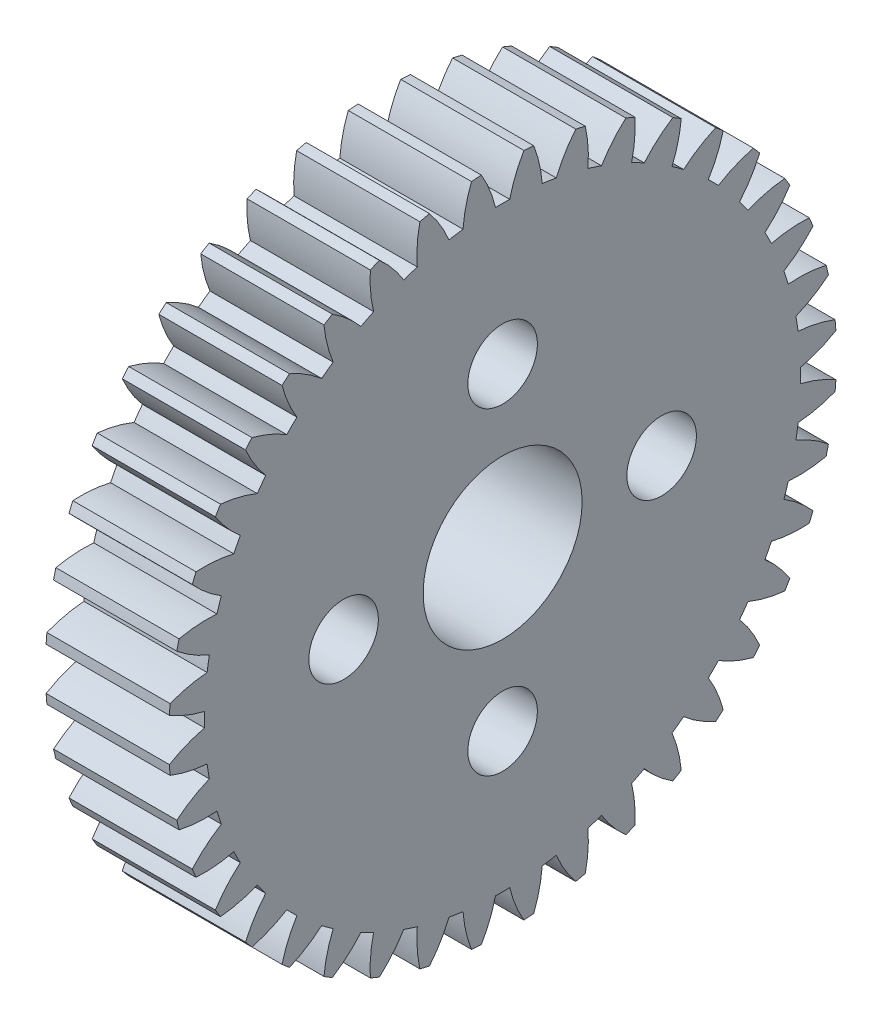
from build123d import *

# Parameters (mm, degrees)
SKETCH1_R           = 4
SKETCH1_R_2         = 1.75
BOSS_EXTRUDE1_DEPTH = 6.2


with BuildPart() as part:
    # Sketch1 → Boss-Extrude1 (new body)
    with BuildSketch(Plane(origin=(0, 0, 0), x_dir=(0, -1, 0), z_dir=(-1, 0, 0))):
        with BuildLine():
            ThreePointArc((-16.276318803, -4.161904158), (-15.328836725, -4.298843929), (-14.371528142, -4.292922065))
            ThreePointArc((-14.371528142, -4.292922065), (-14.264896688, -4.634945899), (-14.150126781, -4.974325389))
            ThreePointArc((-14.150126781, -4.974325389), (-14.928086477, -5.532226367), (-15.614124403, -6.199928961))
            ThreePointArc((-15.614124403, -6.199928961), (-15.521176146, -6.429081664), (-15.424865059, -6.656841436))
            ThreePointArc((-15.424865059, -6.656841436), (-14.467625957, -6.643876399), (-13.523029816, -6.488271387))
            ThreePointArc((-13.523029816, -6.488271387), (-13.364206856, -6.809403506), (-13.197759308, -7.126650702))
            ThreePointArc((-13.197759308, -7.126650702), (-13.878866089, -7.799382702), (-14.452006051, -8.566184746))
            ThreePointArc((-14.452006051, -8.566184746), (-14.324354761, -8.777975887), (-14.193599945, -8.987865186))
            ThreePointArc((-14.193599945, -8.987865186), (-13.250174224, -8.825314583), (-12.341549615, -8.523857935))
            ThreePointArc((-12.341549615, -8.523857935), (-12.134445899, -8.816190999), (-11.920419201, -9.103494223))
            ThreePointArc((-11.920419201, -9.103494223), (-12.487901956, -9.874492351), (-12.934031347, -10.721512632))
            ThreePointArc((-12.934031347, -10.721512632), (-12.774820222, -10.910727212), (-12.612841295, -11.097577865))
            ThreePointArc((-12.612841295, -11.097577865), (-11.706459226, -10.789444232), (-10.856179504, -10.349558811))
            ThreePointArc((-10.856179504, -10.349558811), (-10.605894611, -10.605894611), (-10.349558811, -10.856179504))
            ThreePointArc((-10.349558811, -10.856179504), (-10.789444232, -11.706459226), (-11.097577865, -12.612841295))
            ThreePointArc((-11.097577865, -12.612841295), (-10.910727212, -12.774820222), (-10.721512632, -12.934031347))
            ThreePointArc((-10.721512632, -12.934031347), (-9.874492351, -12.487901956), (-9.103494223, -11.920419201))
            ThreePointArc((-9.103494223, -11.920419201), (-8.816190999, -12.134445899), (-8.523857935, -12.341549615))
            ThreePointArc((-8.523857935, -12.341549615), (-8.825314583, -13.250174224), (-8.987865186, -14.193599945))
            ThreePointArc((-8.987865186, -14.193599945), (-8.777975887, -14.324354761), (-8.566184746, -14.452006051))
            ThreePointArc((-8.566184746, -14.452006051), (-7.799382702, -13.878866089), (-7.126650702, -13.197759308))
            ThreePointArc((-7.126650702, -13.197759308), (-6.809403506, -13.364206856), (-6.488271387, -13.523029816))
            ThreePointArc((-6.488271387, -13.523029816), (-6.643876399, -14.467625957), (-6.656841436, -15.424865059))
            ThreePointArc((-6.656841436, -15.424865059), (-6.429081664, -15.521176146), (-6.199928961, -15.614124403))
            ThreePointArc((-6.199928961, -15.614124403), (-5.532226367, -14.928086477), (-4.974325389, -14.150126781))
            ThreePointArc((-4.974325389, -14.150126781), (-4.634945899, -14.264896688), (-4.292922065, -14.371528142))
            ThreePointArc((-4.292922065, -14.371528142), (-4.298843929, -15.328836725), (-4.161904158, -16.276318803))
            ThreePointArc((-4.161904158, -16.276318803), (-3.921882113, -16.335814663), (-3.68101035, -16.391771192))
            ThreePointArc((-3.68101035, -16.391771192), (-3.128848258, -15.609727833), (-2.699515676, -14.754071171))
            ThreePointArc((-2.699515676, -14.754071171), (-2.346360541, -14.814337421), (-1.991866754, -14.866151749))
            ThreePointArc((-1.991866754, -14.866151749), (-1.847959654, -15.812600658), (-1.564486987, -16.72699556))
            ThreePointArc((-1.564486987, -16.72699556), (-1.318112808, -16.748211207), (-1.071453046, -16.765798173))
            ThreePointArc((-1.071453046, -16.765798173), (-0.648427521, -15.907005884), (-0.358234928, -14.994721362))
            ThreePointArc((-0.358234928, -14.994721362), (0, -14.999), (0.358234928, -14.994721362))
            ThreePointArc((0.358234928, -14.994721362), (0.648427521, -15.907005884), (1.071453046, -16.765798173))
            ThreePointArc((1.071453046, -16.765798173), (1.318112808, -16.748211207), (1.564486987, -16.72699556))
            ThreePointArc((1.564486987, -16.72699556), (1.847959654, -15.812600658), (1.991866754, -14.866151749))
            ThreePointArc((1.991866754, -14.866151749), (2.346360541, -14.814337421), (2.699515676, -14.754071171))
            ThreePointArc((2.699515676, -14.754071171), (3.128848258, -15.609727833), (3.68101035, -16.391771192))
            ThreePointArc((3.68101035, -16.391771192), (3.921882113, -16.335814663), (4.161904158, -16.276318803))
            ThreePointArc((4.161904158, -16.276318803), (4.298843929, -15.328836725), (4.292922065, -14.371528142))
            ThreePointArc((4.292922065, -14.371528142), (4.634945899, -14.264896688), (4.974325389, -14.150126781))
            ThreePointArc((4.974325389, -14.150126781), (5.532226367, -14.928086477), (6.199928961, -15.614124403))
            ThreePointArc((6.199928961, -15.614124403), (6.429081664, -15.521176146), (6.656841436, -15.424865059))
            ThreePointArc((6.656841436, -15.424865059), (6.643876399, -14.467625957), (6.488271387, -13.523029816))
            ThreePointArc((6.488271387, -13.523029816), (6.809403506, -13.364206856), (7.126650702, -13.197759308))
            ThreePointArc((7.126650702, -13.197759308), (7.799382702, -13.878866089), (8.566184746, -14.452006051))
            ThreePointArc((8.566184746, -14.452006051), (8.777975887, -14.324354761), (8.987865186, -14.193599945))
            ThreePointArc((8.987865186, -14.193599945), (8.825314583, -13.250174224), (8.523857935, -12.341549615))
            ThreePointArc((8.523857935, -12.341549615), (8.816190999, -12.134445899), (9.103494223, -11.920419201))
            ThreePointArc((9.103494223, -11.920419201), (9.874492351, -12.487901956), (10.721512632, -12.934031347))
            ThreePointArc((10.721512632, -12.934031347), (10.910727212, -12.774820222), (11.097577865, -12.612841295))
            ThreePointArc((11.097577865, -12.612841295), (10.789444232, -11.706459226), (10.349558811, -10.856179504))
            ThreePointArc((10.349558811, -10.856179504), (10.605894611, -10.605894611), (10.856179504, -10.349558811))
            ThreePointArc((10.856179504, -10.349558811), (11.706459226, -10.789444232), (12.612841295, -11.097577865))
            ThreePointArc((12.612841295, -11.097577865), (12.774820222, -10.910727212), (12.934031347, -10.721512632))
            ThreePointArc((12.934031347, -10.721512632), (12.487901956, -9.874492351), (11.920419201, -9.103494223))
            ThreePointArc((11.920419201, -9.103494223), (12.134445899, -8.816190999), (12.341549615, -8.523857935))
            ThreePointArc((12.341549615, -8.523857935), (13.250174224, -8.825314583), (14.193599945, -8.987865186))
            ThreePointArc((14.193599945, -8.987865186), (14.324354761, -8.777975887), (14.452006051, -8.566184746))
            ThreePointArc((14.452006051, -8.566184746), (13.878866089, -7.799382702), (13.197759308, -7.126650702))
            ThreePointArc((13.197759308, -7.126650702), (13.364206856, -6.809403506), (13.523029816, -6.488271387))
            ThreePointArc((13.523029816, -6.488271387), (14.467625957, -6.643876399), (15.424865059, -6.656841436))
            ThreePointArc((15.424865059, -6.656841436), (15.521176146, -6.429081664), (15.614124403, -6.199928961))
            ThreePointArc((15.614124403, -6.199928961), (14.928086477, -5.532226367), (14.150126781, -4.974325389))
            ThreePointArc((14.150126781, -4.974325389), (14.264896688, -4.634945899), (14.371528142, -4.292922065))
            ThreePointArc((14.371528142, -4.292922065), (15.328836725, -4.298843929), (16.276318803, -4.161904158))
            ThreePointArc((16.276318803, -4.161904158), (16.335814663, -3.921882113), (16.391771192, -3.68101035))
            ThreePointArc((16.391771192, -3.68101035), (15.609727833, -3.128848258), (14.754071171, -2.699515676))
            ThreePointArc((14.754071171, -2.699515676), (14.814337421, -2.346360541), (14.866151749, -1.991866754))
            ThreePointArc((14.866151749, -1.991866754), (15.812600658, -1.847959654), (16.72699556, -1.564486987))
            ThreePointArc((16.72699556, -1.564486987), (16.748211207, -1.318112808), (16.765798173, -1.071453046))
            ThreePointArc((16.765798173, -1.071453046), (15.907005884, -0.648427521), (14.994721362, -0.358234928))
            ThreePointArc((14.994721362, -0.358234928), (14.999, 0), (14.994721362, 0.358234928))
            ThreePointArc((14.994721362, 0.358234928), (15.907005884, 0.648427521), (16.765798173, 1.071453046))
            ThreePointArc((16.765798173, 1.071453046), (16.748211207, 1.318112808), (16.72699556, 1.564486987))
            ThreePointArc((16.72699556, 1.564486987), (15.812600658, 1.847959654), (14.866151749, 1.991866754))
            ThreePointArc((14.866151749, 1.991866754), (14.814337421, 2.346360541), (14.754071171, 2.699515676))
            ThreePointArc((14.754071171, 2.699515676), (15.609727833, 3.128848258), (16.391771192, 3.68101035))
            ThreePointArc((16.391771192, 3.68101035), (16.335814663, 3.921882113), (16.276318803, 4.161904158))
            ThreePointArc((16.276318803, 4.161904158), (15.328836725, 4.298843929), (14.371528142, 4.292922065))
            ThreePointArc((14.371528142, 4.292922065), (14.264896688, 4.634945899), (14.150126781, 4.974325389))
            ThreePointArc((14.150126781, 4.974325389), (14.928086477, 5.532226367), (15.614124403, 6.199928961))
            ThreePointArc((15.614124403, 6.199928961), (15.521176146, 6.429081664), (15.424865059, 6.656841436))
            ThreePointArc((15.424865059, 6.656841436), (14.467625957, 6.643876399), (13.523029816, 6.488271387))
            ThreePointArc((13.523029816, 6.488271387), (13.364206856, 6.809403506), (13.197759308, 7.126650702))
            ThreePointArc((13.197759308, 7.126650702), (13.878866089, 7.799382702), (14.452006051, 8.566184746))
            ThreePointArc((14.452006051, 8.566184746), (14.324354761, 8.777975887), (14.193599945, 8.987865186))
            ThreePointArc((14.193599945, 8.987865186), (13.250174224, 8.825314583), (12.341549615, 8.523857935))
            ThreePointArc((12.341549615, 8.523857935), (12.134445899, 8.816190999), (11.920419201, 9.103494223))
            ThreePointArc((11.920419201, 9.103494223), (12.487901956, 9.874492351), (12.934031347, 10.721512632))
            ThreePointArc((12.934031347, 10.721512632), (12.774820222, 10.910727212), (12.612841295, 11.097577865))
            ThreePointArc((12.612841295, 11.097577865), (11.706459226, 10.789444232), (10.856179504, 10.349558811))
            ThreePointArc((10.856179504, 10.349558811), (10.605894611, 10.605894611), (10.349558811, 10.856179504))
            ThreePointArc((10.349558811, 10.856179504), (10.789444232, 11.706459226), (11.097577865, 12.612841295))
            ThreePointArc((11.097577865, 12.612841295), (10.910727212, 12.774820222), (10.721512632, 12.934031347))
            ThreePointArc((10.721512632, 12.934031347), (9.874492351, 12.487901956), (9.103494223, 11.920419201))
            ThreePointArc((9.103494223, 11.920419201), (8.816190999, 12.134445899), (8.523857935, 12.341549615))
            ThreePointArc((8.523857935, 12.341549615), (8.825314583, 13.250174224), (8.987865186, 14.193599945))
            ThreePointArc((8.987865186, 14.193599945), (8.777975887, 14.324354761), (8.566184746, 14.452006051))
            ThreePointArc((8.566184746, 14.452006051), (7.799382702, 13.878866089), (7.126650702, 13.197759308))
            ThreePointArc((7.126650702, 13.197759308), (6.809403506, 13.364206856), (6.488271387, 13.523029816))
            ThreePointArc((6.488271387, 13.523029816), (6.643876399, 14.467625957), (6.656841436, 15.424865059))
            ThreePointArc((6.656841436, 15.424865059), (6.429081664, 15.521176146), (6.199928961, 15.614124403))
            ThreePointArc((6.199928961, 15.614124403), (5.532226367, 14.928086477), (4.974325389, 14.150126781))
            ThreePointArc((4.974325389, 14.150126781), (4.634945899, 14.264896688), (4.292922065, 14.371528142))
            ThreePointArc((4.292922065, 14.371528142), (4.298843929, 15.328836725), (4.161904158, 16.276318803))
            ThreePointArc((4.161904158, 16.276318803), (3.921882113, 16.335814663), (3.68101035, 16.391771192))
            ThreePointArc((3.68101035, 16.391771192), (3.128848258, 15.609727833), (2.699515676, 14.754071171))
            ThreePointArc((2.699515676, 14.754071171), (2.346360541, 14.814337421), (1.991866754, 14.866151749))
            ThreePointArc((1.991866754, 14.866151749), (1.847959654, 15.812600658), (1.564486987, 16.72699556))
            ThreePointArc((1.564486987, 16.72699556), (1.318112808, 16.748211207), (1.071453046, 16.765798173))
            ThreePointArc((1.071453046, 16.765798173), (0.648427521, 15.907005884), (0.358234928, 14.994721362))
            ThreePointArc((0.358234928, 14.994721362), (0, 14.999), (-0.358234928, 14.994721362))
            ThreePointArc((-0.358234928, 14.994721362), (-0.648427521, 15.907005884), (-1.071453046, 16.765798173))
            ThreePointArc((-1.071453046, 16.765798173), (-1.318112808, 16.748211207), (-1.564486987, 16.72699556))
            ThreePointArc((-1.564486987, 16.72699556), (-1.847959654, 15.812600658), (-1.991866754, 14.866151749))
            ThreePointArc((-1.991866754, 14.866151749), (-2.346360541, 14.814337421), (-2.699515676, 14.754071171))
            ThreePointArc((-2.699515676, 14.754071171), (-3.128848258, 15.609727833), (-3.68101035, 16.391771192))
            ThreePointArc((-3.68101035, 16.391771192), (-3.921882113, 16.335814663), (-4.161904158, 16.276318803))
            ThreePointArc((-4.161904158, 16.276318803), (-4.298843929, 15.328836725), (-4.292922065, 14.371528142))
            ThreePointArc((-4.292922065, 14.371528142), (-4.634945899, 14.264896688), (-4.974325389, 14.150126781))
            ThreePointArc((-4.974325389, 14.150126781), (-5.532226367, 14.928086477), (-6.199928961, 15.614124403))
            ThreePointArc((-6.199928961, 15.614124403), (-6.429081664, 15.521176146), (-6.656841436, 15.424865059))
            ThreePointArc((-6.656841436, 15.424865059), (-6.643876399, 14.467625957), (-6.488271387, 13.523029816))
            ThreePointArc((-6.488271387, 13.523029816), (-6.809403506, 13.364206856), (-7.126650702, 13.197759308))
            ThreePointArc((-7.126650702, 13.197759308), (-7.799382702, 13.878866089), (-8.566184746, 14.452006051))
            ThreePointArc((-8.566184746, 14.452006051), (-8.777975887, 14.324354761), (-8.987865186, 14.193599945))
            ThreePointArc((-8.987865186, 14.193599945), (-8.825314583, 13.250174224), (-8.523857935, 12.341549615))
            ThreePointArc((-8.523857935, 12.341549615), (-8.816190999, 12.134445899), (-9.103494223, 11.920419201))
            ThreePointArc((-9.103494223, 11.920419201), (-9.874492351, 12.487901956), (-10.721512632, 12.934031347))
            ThreePointArc((-10.721512632, 12.934031347), (-10.910727212, 12.774820222), (-11.097577865, 12.612841295))
            ThreePointArc((-11.097577865, 12.612841295), (-10.789444232, 11.706459226), (-10.349558811, 10.856179504))
            ThreePointArc((-10.349558811, 10.856179504), (-10.605894611, 10.605894611), (-10.856179504, 10.349558811))
            ThreePointArc((-10.856179504, 10.349558811), (-11.706459226, 10.789444232), (-12.612841295, 11.097577865))
            ThreePointArc((-12.612841295, 11.097577865), (-12.774820222, 10.910727212), (-12.934031347, 10.721512632))
            ThreePointArc((-12.934031347, 10.721512632), (-12.487901956, 9.874492351), (-11.920419201, 9.103494223))
            ThreePointArc((-11.920419201, 9.103494223), (-12.134445899, 8.816190999), (-12.341549615, 8.523857935))
            ThreePointArc((-12.341549615, 8.523857935), (-13.250174224, 8.825314583), (-14.193599945, 8.987865186))
            ThreePointArc((-14.193599945, 8.987865186), (-14.324354761, 8.777975887), (-14.452006051, 8.566184746))
            ThreePointArc((-14.452006051, 8.566184746), (-13.878866089, 7.799382702), (-13.197759308, 7.126650702))
            ThreePointArc((-13.197759308, 7.126650702), (-13.364206856, 6.809403506), (-13.523029816, 6.488271387))
            ThreePointArc((-13.523029816, 6.488271387), (-14.467625957, 6.643876399), (-15.424865059, 6.656841436))
            ThreePointArc((-15.424865059, 6.656841436), (-15.521176146, 6.429081664), (-15.614124403, 6.199928961))
            ThreePointArc((-15.614124403, 6.199928961), (-14.928086477, 5.532226367), (-14.150126781, 4.974325389))
            ThreePointArc((-14.150126781, 4.974325389), (-14.264896688, 4.634945899), (-14.371528142, 4.292922065))
            ThreePointArc((-14.371528142, 4.292922065), (-15.328836725, 4.298843929), (-16.276318803, 4.161904158))
            ThreePointArc((-16.276318803, 4.161904158), (-16.335814663, 3.921882113), (-16.391771192, 3.68101035))
            ThreePointArc((-16.391771192, 3.68101035), (-15.609727833, 3.128848258), (-14.754071171, 2.699515676))
            ThreePointArc((-14.754071171, 2.699515676), (-14.814337421, 2.346360541), (-14.866151749, 1.991866754))
            ThreePointArc((-14.866151749, 1.991866754), (-15.812600658, 1.847959654), (-16.72699556, 1.564486987))
            ThreePointArc((-16.72699556, 1.564486987), (-16.748211207, 1.318112808), (-16.765798173, 1.071453046))
            ThreePointArc((-16.765798173, 1.071453046), (-15.907005884, 0.648427521), (-14.994721362, 0.358234928))
            ThreePointArc((-14.994721362, 0.358234928), (-14.999, 0), (-14.994721362, -0.358234928))
            ThreePointArc((-14.994721362, -0.358234928), (-15.907005884, -0.648427521), (-16.765798173, -1.071453046))
            ThreePointArc((-16.765798173, -1.071453046), (-16.748211207, -1.318112808), (-16.72699556, -1.564486987))
            ThreePointArc((-16.72699556, -1.564486987), (-15.812600658, -1.847959654), (-14.866151749, -1.991866754))
            ThreePointArc((-14.866151749, -1.991866754), (-14.814337421, -2.346360541), (-14.754071171, -2.699515676))
            ThreePointArc((-14.754071171, -2.699515676), (-15.609727833, -3.128848258), (-16.391771192, -3.68101035))
            ThreePointArc((-16.391771192, -3.68101035), (-16.335814663, -3.921882113), (-16.276318803, -4.161904158))
        make_face()
        with Locations(Location((0, 0, 0), (0, 0, 270))):
            Circle(SKETCH1_R, mode=Mode.SUBTRACT)
        with Locations(Location((0, 8, 0), (0, 0, 270))):
            Circle(SKETCH1_R_2, mode=Mode.SUBTRACT)
        with Locations(Location((-8, 0, 0), (0, 0, 270))):
            Circle(SKETCH1_R_2, mode=Mode.SUBTRACT)
        with Locations(Location((8, 0, 0), (0, 0, 270))):
            Circle(SKETCH1_R_2, mode=Mode.SUBTRACT)
        with Locations(Location((0, -8, 0), (0, 0, 270))):
            Circle(SKETCH1_R_2, mode=Mode.SUBTRACT)
    extrude(amount=-BOSS_EXTRUDE1_DEPTH)


solid = part.part
